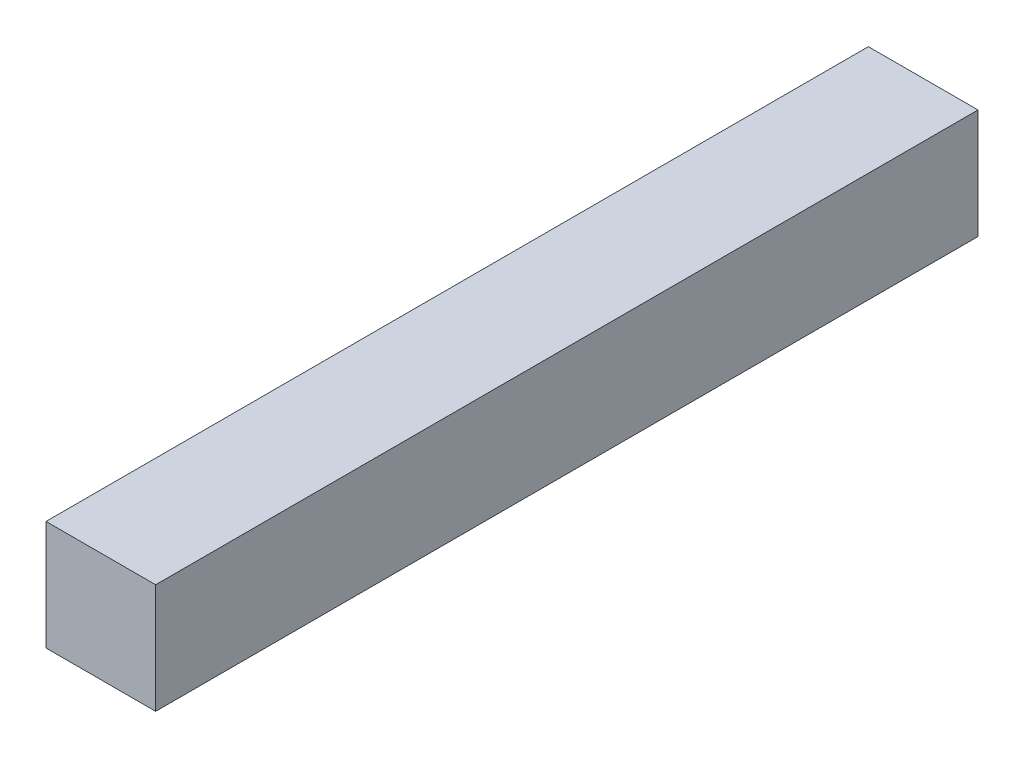
from build123d import *

# Parameters (mm, degrees)
SKETCH1_W           = 40
SKETCH1_H           = 300
BOSS_EXTRUDE1_DEPTH = 40


with BuildPart() as part:
    # Sketch1 → Boss-Extrude1 (new body)
    with BuildSketch(Plane(origin=(0, 0, 0), x_dir=(1, 0, 0), z_dir=(0, 1, 0))):
        with Locations((3.033224068, -136.707317073)):
            Rectangle(SKETCH1_W, SKETCH1_H)
    extrude(amount=BOSS_EXTRUDE1_DEPTH)


solid = part.part
